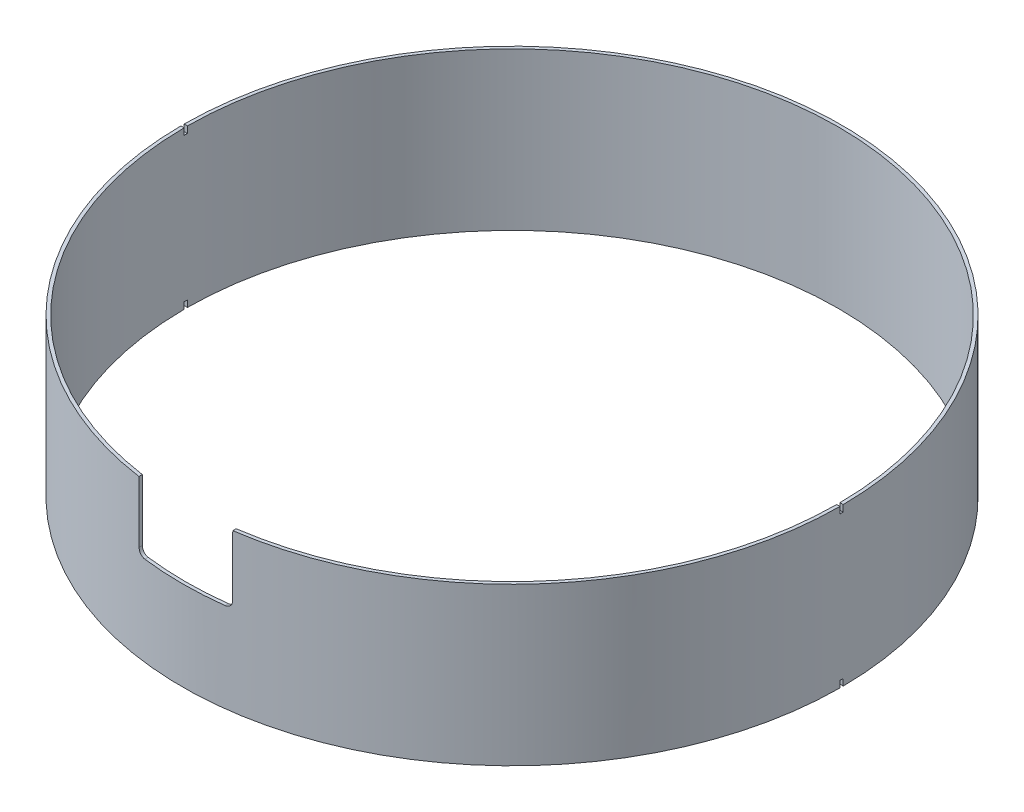
from build123d import *

# Parameters (mm, degrees)
SKETCH_1_R               = 50.3
SKETCH_1_R_2             = 49.8
EXTRUDE_1_DEPTH          = 24
CUT_EXTRUDE_1_DEPTH      = 52
CUT_EXTRUDE_2_DEPTH      = 52
CUT_EXTRUDE_2_DEPTH_BACK = 52
FILLET_1_R               = 1


with BuildPart() as part:
    # Эскиз1 → Бобышка-Вытянуть1 (new body)
    with BuildSketch(Plane(origin=(0, 0, 0), x_dir=(1, 0, 0), z_dir=(0, 1, 0))):
        Circle(SKETCH_1_R)
        Circle(SKETCH_1_R_2, mode=Mode.SUBTRACT)
    extrude(amount=EXTRUDE_1_DEPTH)

    # Эскиз2 → Вырез-Вытянуть1 (cut)
    with BuildSketch(Plane.XY):
        Polygon((-7.130200452, 13.65), (-7.158835795, 24), (7.158835795, 24), (7.130200452, 13.65), align=None)
    extrude(amount=CUT_EXTRUDE_1_DEPTH, mode=Mode.SUBTRACT)

    # Эскиз3 → Вырез-Вытянуть2 (cut, two sides: drawn at the far end of the back side and taken through both)
    with BuildSketch(Plane(origin=(0, 0, 0), x_dir=(0, 0, -1), z_dir=(1, 0, 0)).offset(-CUT_EXTRUDE_2_DEPTH_BACK)):
        Polygon((0, 24), (0.25, 24), (0.25, 23), (-0.25, 23), (-0.25, 24), align=None)
        Polygon((0.25, 1), (0.25, 0), (0, 0), (-0.25, 0), (-0.25, 1), align=None)
    extrude(amount=CUT_EXTRUDE_2_DEPTH + CUT_EXTRUDE_2_DEPTH_BACK, mode=Mode.SUBTRACT)

    # Скругление1
    fillet_1_edges = [part.edges().sort_by_distance(p)[0] for p in [
        (7.130200452, 13.65, 49.539493808),
        (-7.130200452, 13.65, 49.539493808),
    ]]
    fillet(fillet_1_edges, radius=FILLET_1_R)


solid = part.part
